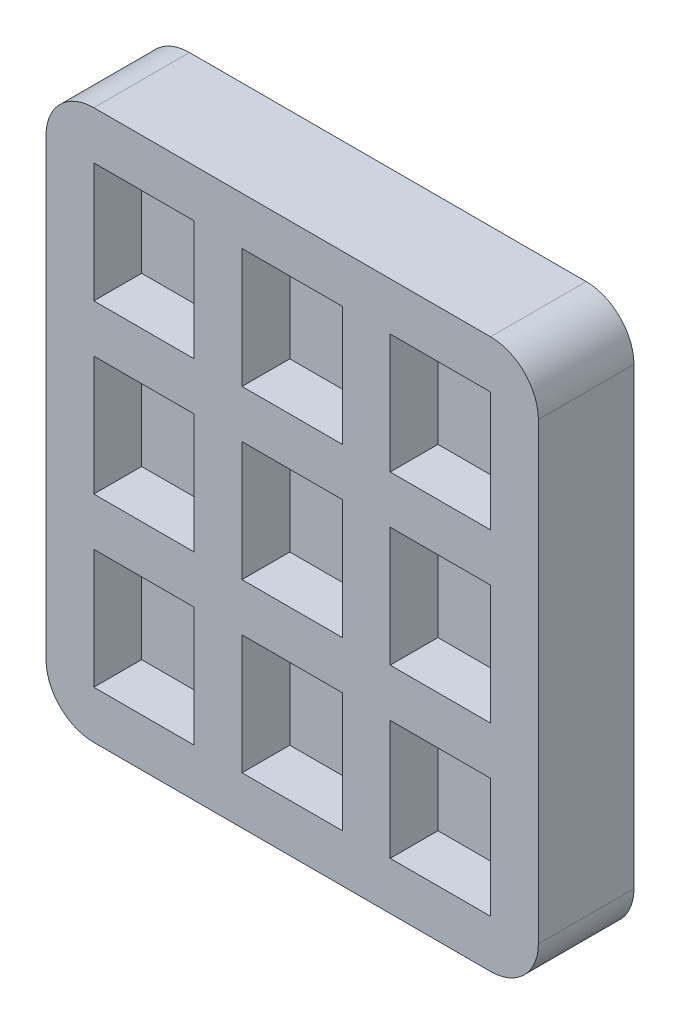
from build123d import *

# Parameters (mm, degrees)
SKETCH1_W           = 103
SKETCH1_H           = 115
BOSS_EXTRUDE2_DEPTH = 20
SKETCH3_W           = 21
SKETCH3_H           = 25
CUT_EXTRUDE1_DEPTH  = 10
CUT_EXTRUDE2_DEPTH  = 46


with BuildPart() as part:
    # Sketch1 → Boss-Extrude2 (new body)
    with BuildSketch(Plane.XY):
        with Locations((51.5, 57.5)):
            Rectangle(SKETCH1_W, SKETCH1_H)
    extrude(amount=BOSS_EXTRUDE2_DEPTH)

    # Sketch3 → Cut-Extrude1 (cut)
    with BuildSketch(Plane.XY.offset(20)):
        with Locations((20.5, 92.5)):
            Rectangle(SKETCH3_W, SKETCH3_H)
        with Locations((51.5, 92.5)):
            Rectangle(SKETCH3_W, SKETCH3_H)
        with Locations((82.5, 92.5)):
            Rectangle(SKETCH3_W, SKETCH3_H)
        Polygon((10, 70), (10, 54.37934433), (10, 45), (31, 45), (31, 70), align=None)
        with Locations((51.5, 57.5)):
            Rectangle(SKETCH3_W, SKETCH3_H)
        Polygon((10, 35), (10, 17.462651727), (10, 10), (31, 10), (31, 35), align=None)
        with Locations((51.5, 22.5)):
            Rectangle(SKETCH3_W, SKETCH3_H)
        with Locations((82.5, 22.5)):
            Rectangle(SKETCH3_W, SKETCH3_H)
        with Locations((82.5, 57.5)):
            Rectangle(SKETCH3_W, SKETCH3_H)
    extrude(amount=-CUT_EXTRUDE1_DEPTH, mode=Mode.SUBTRACT)

    # Sketch4 → Cut-Extrude2 (cut)
    with BuildSketch(Plane.XY.offset(20)):
        with BuildLine():
            Line((0, 105), (0, 115))
            Line((0, 115), (10, 115))
            ThreePointArc((10, 115), (2.928932188, 112.071067812), (0, 105))
        make_face()
        with BuildLine():
            Line((93, 115), (103, 115))
            Line((103, 115), (103, 105))
            ThreePointArc((103, 105), (100.071067812, 112.071067812), (93, 115))
        make_face()
        with BuildLine():
            Line((103, 10), (103, 0))
            Line((103, 0), (93, 0))
            ThreePointArc((93, 0), (100.071067812, 2.928932188), (103, 10))
        make_face()
        with BuildLine():
            Line((10, 0), (0, 0))
            Line((0, 0), (0, 10))
            ThreePointArc((0, 10), (2.928932188, 2.928932188), (10, 0))
        make_face()
    extrude(amount=-CUT_EXTRUDE2_DEPTH, mode=Mode.SUBTRACT)


solid = part.part
